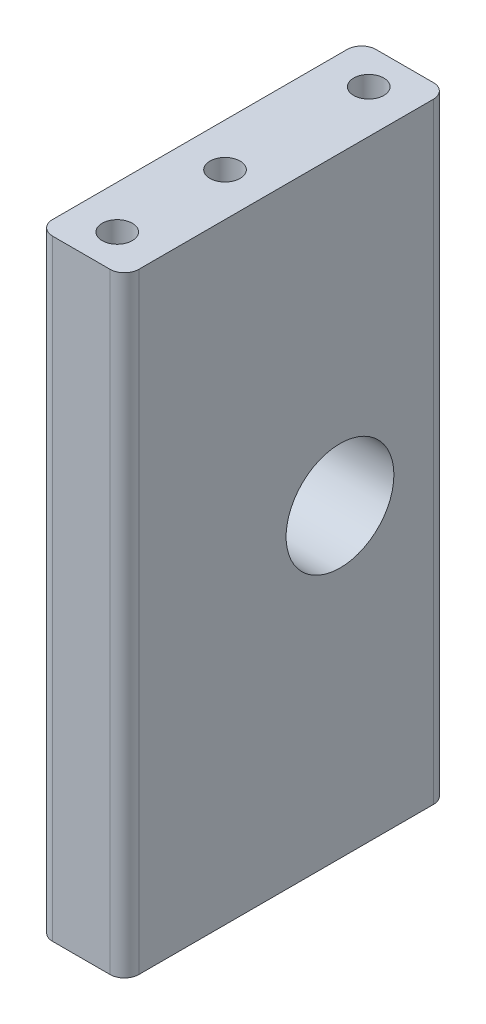
from build123d import *

# Parameters (mm, degrees)
SKETCH1_W                   = 12
SKETCH1_H                   = 45
BOSS_EXTRUDE1_DEPTH         = 85
TAP_DRILL_FOR_M5X0_8_TAP1_D = 4.2
CUT_EXTRUDE1_REACH          = 92.934
SKETCH3_R                   = 7.5
FILLET1_R                   = 2


with BuildPart() as part:
    # Sketch1 → Boss-Extrude1 (new body)
    with BuildSketch(Plane(origin=(0, 0, 0), x_dir=(1, 0, 0), z_dir=(0, 1, 0))):
        with Locations((0, -7.5)):
            Rectangle(SKETCH1_W, SKETCH1_H)
    extrude(amount=-BOSS_EXTRUDE1_DEPTH)

    # Tap Drill for M5x0.8 Tap1 (through all)
    with Locations(Plane(origin=(0, 0, -10), x_dir=(0, 0, 1), z_dir=(0, 1, 0))):
        with Locations((0, 0), (20, 0), (35, 0)):
            Hole(TAP_DRILL_FOR_M5X0_8_TAP1_D / 2)

    # Sketch3 → Cut-Extrude1 (cut, up to next)
    with BuildSketch(Plane(origin=(6, 0, 0), x_dir=(0, 0, -1), z_dir=(1, 0, 0)), mode=Mode.PRIVATE) as cut_extrude1_sk1:
        with Locations((0, -42.5)):
            Circle(SKETCH3_R)
    cut_extrude1_tool1 = extrude(cut_extrude1_sk1.sketch, amount=-CUT_EXTRUDE1_REACH, mode=Mode.PRIVATE) & part.part
    add(cut_extrude1_tool1.solids().sort_by_distance((6, -42.5, 0))[0], mode=Mode.SUBTRACT)

    # Fillet1
    fillet1_edges = [part.edges().sort_by_distance(p)[0] for p in [
        (6, -42.5, 30),
        (-6, -42.5, 30),
        (-6, -42.5, -15),
        (6, -42.5, -15),
    ]]
    fillet(fillet1_edges, radius=FILLET1_R)


solid = part.part
